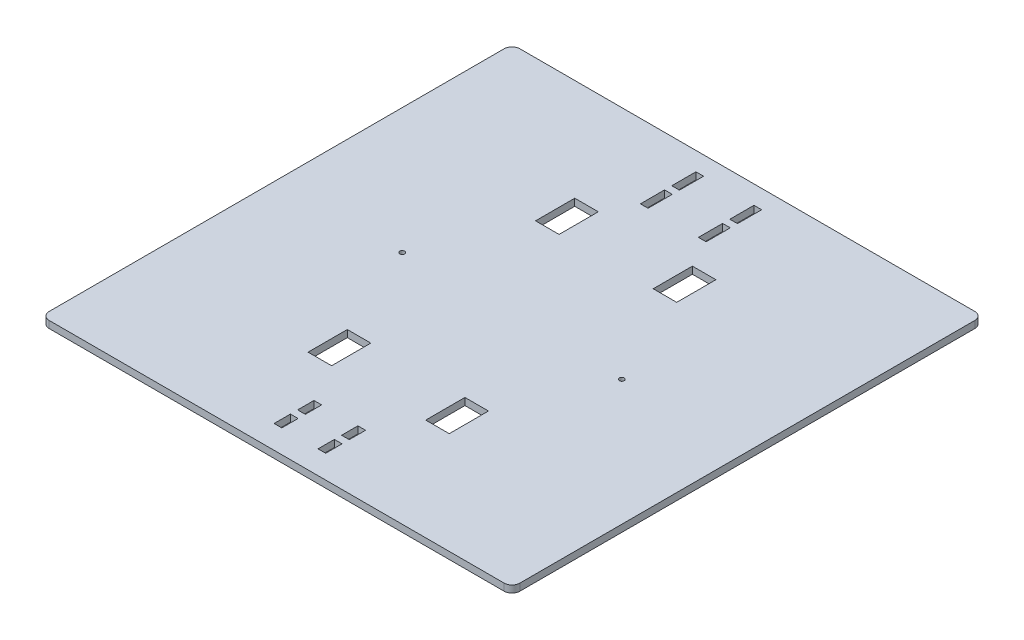
from build123d import *

# Parameters (mm, degrees)
SKETCH1_W           = 300
SKETCH1_H           = 300
BOSS_EXTRUDE1_DEPTH = 4.5
SKETCH3_W           = 4.9
SKETCH3_H           = 15.4
CUT_EXTRUDE1_DEPTH  = 213.179758695
SKETCH6_W           = 15
SKETCH6_H           = 25
CUT_EXTRUDE2_DEPTH  = 213.179758695
SKETCH7_W           = 4.9
SKETCH7_H           = 10.4
CUT_EXTRUDE3_DEPTH  = 213.179758695
SKETCH8_R           = 1.55
CUT_EXTRUDE4_DEPTH  = 213.179758695
FILLET1_R           = 5


with BuildPart() as part:
    # Sketch1 → Boss-Extrude1 (new body)
    with BuildSketch(Plane(origin=(0, 0, 0), x_dir=(1, 0, 0), z_dir=(0, 1, 0))):
        Rectangle(SKETCH1_W, SKETCH1_H)
    extrude(amount=BOSS_EXTRUDE1_DEPTH)

    # Sketch3 → Cut-Extrude1 (cut, through all)
    with BuildSketch(Plane.XZ):
        with Locations((18.5, -130.5)):
            Rectangle(SKETCH3_W, SKETCH3_H)
        with Locations((18.5, -110.5)):
            Rectangle(SKETCH3_W, SKETCH3_H)
        with Locations((-18.5, -110.5)):
            Rectangle(SKETCH3_W, SKETCH3_H)
        with Locations((-18.5, -130.5)):
            Rectangle(SKETCH3_W, SKETCH3_H)
    extrude(amount=-CUT_EXTRUDE1_DEPTH, mode=Mode.SUBTRACT)

    # Sketch6 → Cut-Extrude2 (cut, through all)
    with BuildSketch(Plane.XZ):
        with Locations((37.5, -72.5)):
            Rectangle(SKETCH6_W, SKETCH6_H)
        with Locations((37.5, 72.5)):
            Rectangle(SKETCH6_W, SKETCH6_H)
        with Locations((-37.5, 72.5)):
            Rectangle(SKETCH6_W, SKETCH6_H)
        with Locations((-37.5, -72.5)):
            Rectangle(SKETCH6_W, SKETCH6_H)
    extrude(amount=-CUT_EXTRUDE2_DEPTH, mode=Mode.SUBTRACT)

    # Sketch7 → Cut-Extrude3 (cut, through all)
    with BuildSketch(Plane.XZ):
        with Locations((14, 130)):
            Rectangle(SKETCH7_W, SKETCH7_H)
        with Locations((-14, 130)):
            Rectangle(SKETCH7_W, SKETCH7_H)
        with Locations((-14, 115)):
            Rectangle(SKETCH7_W, SKETCH7_H)
        with Locations((14, 115)):
            Rectangle(SKETCH7_W, SKETCH7_H)
    extrude(amount=-CUT_EXTRUDE3_DEPTH, mode=Mode.SUBTRACT)

    # Sketch8 → Cut-Extrude4 (cut, through all)
    with BuildSketch(Plane.XZ):
        with Locations(Location((70, 0, 0), (0, 0, 270))):
            Circle(SKETCH8_R)
        with Locations(Location((-70, 0, 0), (0, 0, 90))):
            Circle(SKETCH8_R)
    extrude(amount=-CUT_EXTRUDE4_DEPTH, mode=Mode.SUBTRACT)

    # Fillet1
    fillet1_edges = [part.edges().sort_by_distance(p)[0] for p in [
        (150, 2.25, 150),
        (-150, 2.25, 150),
        (-150, 2.25, -150),
        (150, 2.25, -150),
    ]]
    fillet(fillet1_edges, radius=FILLET1_R)


solid = part.part
